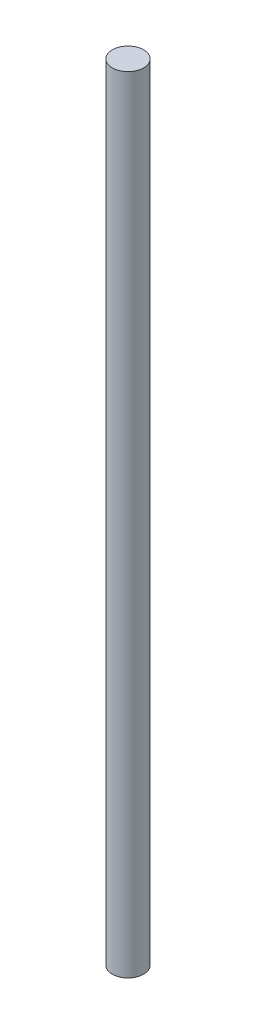
from build123d import *

# Parameters (mm, degrees)
SKETCH1_R           = 5
BOSS_EXTRUDE1_DEPTH = 125


with BuildPart() as part:
    # Sketch1 → Boss-Extrude1 (new, symmetric)
    with BuildSketch(Plane(origin=(0, 0, 0), x_dir=(1, 0, 0), z_dir=(0, 1, 0))):
        with Locations(Location((0, 0, 0), (0, 0, 270))):
            Circle(SKETCH1_R)
    extrude(amount=BOSS_EXTRUDE1_DEPTH, both=True)


solid = part.part
